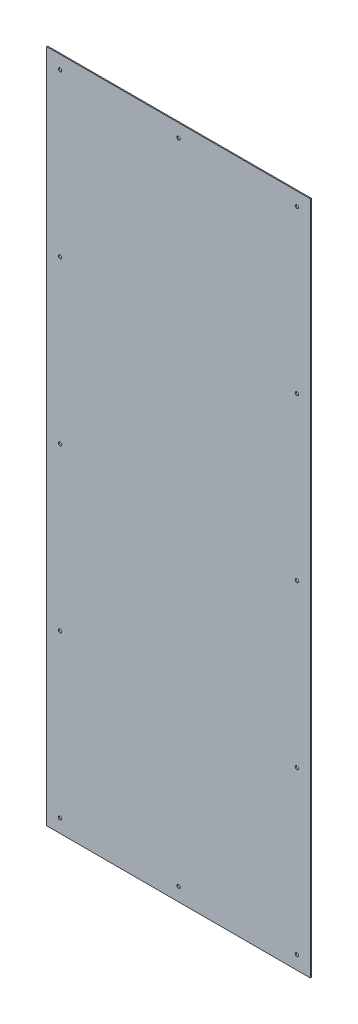
from build123d import *

# Parameters (mm, degrees)
CROQUIS1_W              = 500
CROQUIS1_H              = 1280
SALIENTE_EXTRUIR1_DEPTH = 1.9
CROQUIS2_R              = 3.175
CORTAR_EXTRUIR1_DEPTH   = 10


with BuildPart() as part:
    # Croquis1 → Saliente-Extruir1 (new body)
    with BuildSketch(Plane.XY):
        Rectangle(CROQUIS1_W, CROQUIS1_H)
    extrude(amount=SALIENTE_EXTRUIR1_DEPTH)

    # Croquis2 → Cortar-Extruir1 (cut)
    with BuildSketch(Plane.XY.offset(1.9)):
        with Locations((-224.6, 614.6)):
            Circle(CROQUIS2_R)
        with Locations((224.6, 614.6)):
            Circle(CROQUIS2_R)
        with Locations((0, 614.6)):
            Circle(CROQUIS2_R)
        with Locations((224.6, -614.6)):
            Circle(CROQUIS2_R)
        with Locations((0, -614.6)):
            Circle(CROQUIS2_R)
        with Locations((-224.6, -614.6)):
            Circle(CROQUIS2_R)
        with Locations((-224.6, 0)):
            Circle(CROQUIS2_R)
        with Locations((224.6, 0)):
            Circle(CROQUIS2_R)
        with Locations((-224.6, 307.3)):
            Circle(CROQUIS2_R)
        with Locations((224.6, 307.3)):
            Circle(CROQUIS2_R)
        with Locations((-224.6, -307.3)):
            Circle(CROQUIS2_R)
        with Locations((224.6, -307.3)):
            Circle(CROQUIS2_R)
    extrude(amount=-CORTAR_EXTRUIR1_DEPTH, mode=Mode.SUBTRACT)


solid = part.part
